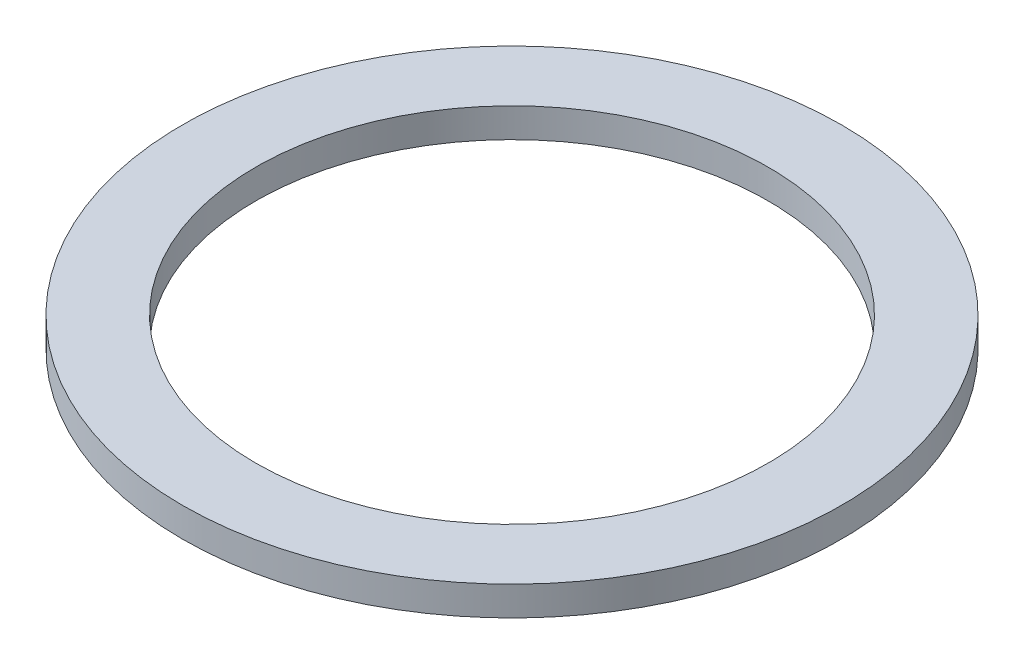
from build123d import *

# Parameters (mm, degrees)
CROQUIS1_R              = 45
CROQUIS1_R_2            = 35
SALIENTE_EXTRUIR1_DEPTH = 4


with BuildPart() as part:
    # Croquis1 → Saliente-Extruir1 (new body)
    with BuildSketch(Plane(origin=(0, 0, 0), x_dir=(1, 0, 0), z_dir=(0, 1, 0))):
        with Locations(Location((0, 0, 0), (0, 0, 270))):
            Circle(CROQUIS1_R)
        with Locations(Location((0, 0, 0), (0, 0, 270))):
            Circle(CROQUIS1_R_2, mode=Mode.SUBTRACT)
    extrude(amount=SALIENTE_EXTRUIR1_DEPTH)


solid = part.part
